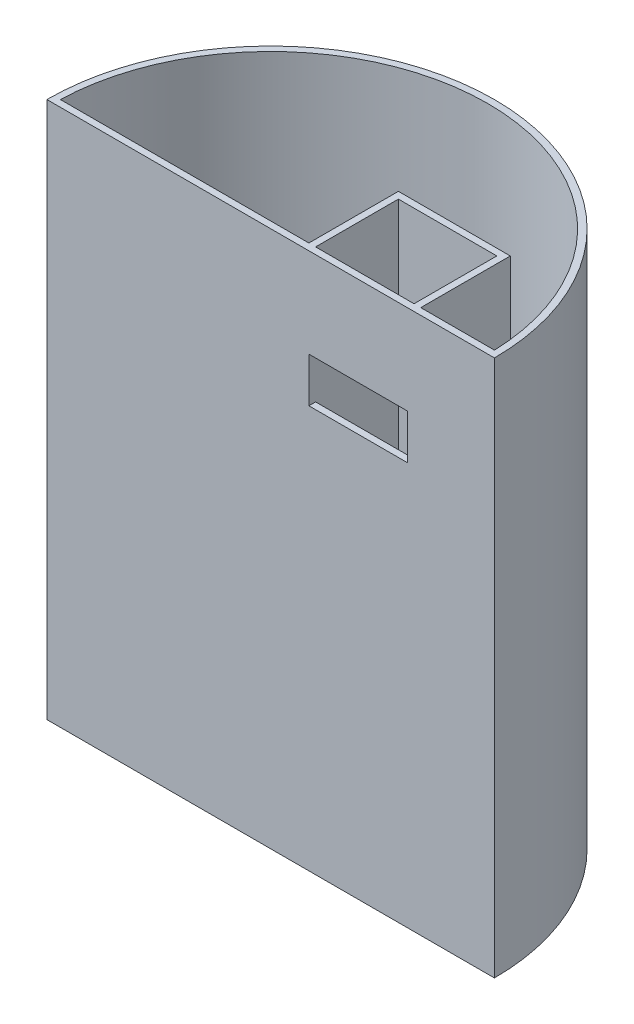
from build123d import *

# Parameters (mm, degrees)
EXTRUDE_1_DEPTH          = 240
CUT_EXTRUDE_3_DEPTH      = 326.109212419
CUT_EXTRUDE_3_DEPTH_BACK = 326.109212419
EXTRUDE_3_DEPTH          = 3
SKETCH_11_W              = 50
SKETCH_11_H              = 186
EXTRUDE_5_DEPTH          = 40
CUT_EXTRUDE_4_DEPTH      = 183
SKETCH_13_R              = 10
SKETCH_13_R_2            = 3
SKETCH_13_R_3            = 5.2
CUT_EXTRUDE_5_DEPTH      = 187
SKETCH_16_W              = 44
SKETCH_16_H              = 20
CUT_EXTRUDE_6_DEPTH      = 3


with BuildPart() as part:
    # 草图2 → 凸台-拉伸1 (new body)
    with BuildSketch(Plane(origin=(0, 0, 0), x_dir=(1, 0, 0), z_dir=(0, 1, 0))):
        with BuildLine():
            Line((0, 0), (200, 0))
            ThreePointArc((200, 0), (100, 100), (0, 0))
        make_face()
    extrude(amount=EXTRUDE_1_DEPTH)

    # 草图4 → 切除-拉伸3 (cut, two sides: drawn at the far end of the back side and taken through both)
    with BuildSketch(Plane(origin=(0, 4, 0), x_dir=(1, 0, 0), z_dir=(0, 1, 0)).offset(-CUT_EXTRUDE_3_DEPTH_BACK)):
        with BuildLine():
            Line((3, 3), (197, 3))
            ThreePointArc((197, 3), (100, 96.979861709), (3, 3))
        make_face()
    extrude(amount=CUT_EXTRUDE_3_DEPTH + CUT_EXTRUDE_3_DEPTH_BACK, mode=Mode.SUBTRACT)

    # 草图10 → 凸台-拉伸3 (add)
    with BuildSketch(Plane(origin=(0, 0, 0), x_dir=(1, 0, 0), z_dir=(0, 1, 0))):
        with BuildLine():
            Line((3, 3), (197, 3))
            ThreePointArc((197, 3), (100, 96.979861709), (3, 3))
        make_face()
    extrude(amount=EXTRUDE_3_DEPTH)

    # 草图11 → 凸台-拉伸5 (add)
    with BuildSketch(Plane(origin=(0, 0, -3), x_dir=(-1, 0, 0), z_dir=(0, 0, -1))):
        with Locations((-139.082312279, 147)):
            Rectangle(SKETCH_11_W, SKETCH_11_H)
    extrude(amount=EXTRUDE_5_DEPTH)

    # 草图12 → 切除-拉伸4 (cut)
    with BuildSketch(Plane(origin=(0, 240, 0), x_dir=(1, 0, 0), z_dir=(0, 1, 0))):
        Polygon((117.082312279, 3), (117.082312279, 40), (128.082312279, 40), (131.082312279, 40), (161.082312279, 40), (161.082312279, 3), (131.082312279, 3), (128.082312279, 3), align=None)
    extrude(amount=-CUT_EXTRUDE_4_DEPTH, mode=Mode.SUBTRACT)

    # 草图13 → 切除-拉伸5 (cut)
    with BuildSketch(Plane(origin=(0, 240, 0), x_dir=(1, 0, 0), z_dir=(0, 1, 0))):
        with Locations(Location((144.331422693, 21.213361888, 0), (0, 0, 270))):
            Circle(SKETCH_13_R)
        with Locations(Location((123.835336357, 21.213361888, 0), (0, 0, 270))):
            Circle(SKETCH_13_R_2)
        with Locations(Location((123.835336357, 10.323097486, 0), (0, 0, 270))):
            Circle(SKETCH_13_R_3)
        with Locations(Location((123.835336357, 33.165384847, 0), (0, 0, 270))):
            Circle(SKETCH_13_R_3)
    extrude(amount=-CUT_EXTRUDE_5_DEPTH, mode=Mode.SUBTRACT)

    # 草图16 → 切除-拉伸6 (cut)
    with BuildSketch(Plane.XY):
        with Locations((139.082312279, 190)):
            Rectangle(SKETCH_16_W, SKETCH_16_H)
    extrude(amount=-CUT_EXTRUDE_6_DEPTH, mode=Mode.SUBTRACT)


solid = part.part
